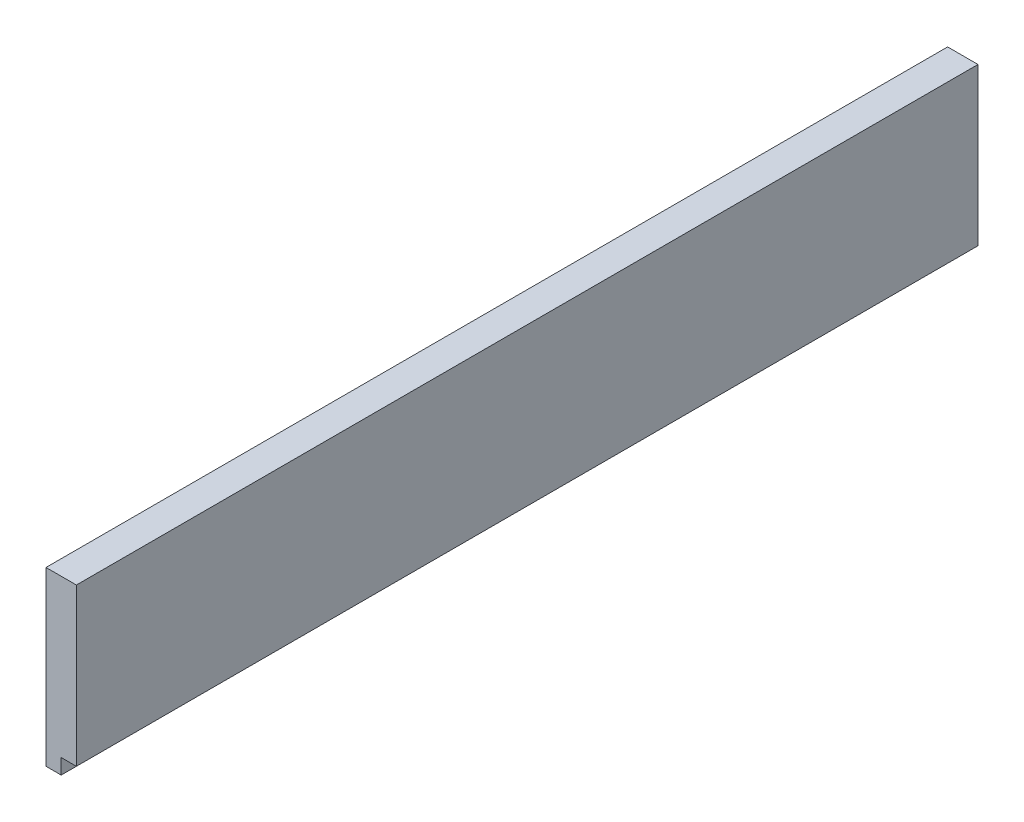
from build123d import *

# Parameters (mm, degrees)
EXTRUDE_1_DEPTH = 890


with BuildPart() as part:
    # Эскиз1 → Бобышка-Вытянуть1 (new body)
    with BuildSketch(Plane.XY):
        Polygon((0, 0), (15, 0), (15, 15), (30, 15), (30, 170), (0, 170), align=None)
    extrude(amount=EXTRUDE_1_DEPTH)


solid = part.part
